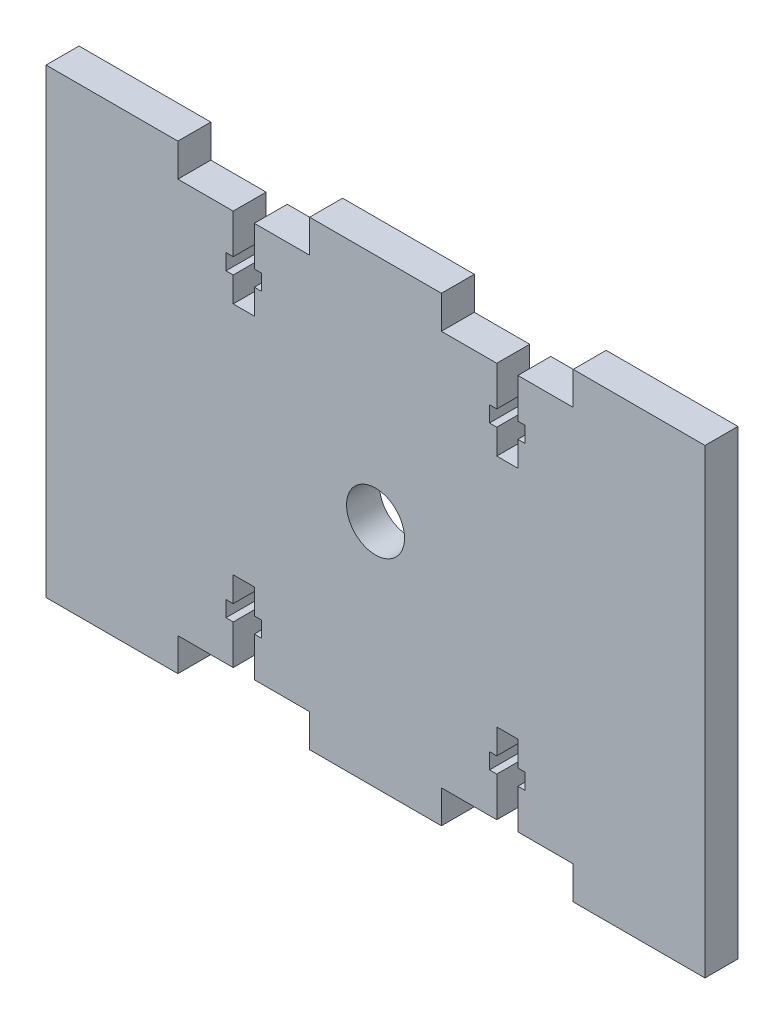
from build123d import *

# Parameters (mm, degrees)
SKETCH2_W           = 127
SKETCH2_H           = 76.2
BOSS_EXTRUDE1_DEPTH = 6.35
SKETCH3_W           = 25.4
SKETCH3_H           = 6.35
BOSS_EXTRUDE2_DEPTH = 6.35
CUT_EXTRUDE1_DEPTH  = 78.771299333
SKETCH5_R           = 5.588
CUT_EXTRUDE2_DEPTH  = 78.771299333


with BuildPart() as part:
    # Sketch2 → Boss-Extrude1 (new body)
    with BuildSketch(Plane.XY):
        Rectangle(SKETCH2_W, SKETCH2_H)
    extrude(amount=BOSS_EXTRUDE1_DEPTH)

    # Sketch3 → Boss-Extrude2 (add)
    with BuildSketch(Plane.XY.offset(6.35)):
        with Locations((0, 41.275)):
            Rectangle(SKETCH3_W, SKETCH3_H)
        with Locations((50.8, 41.275)):
            Rectangle(SKETCH3_W, SKETCH3_H)
        with Locations((50.8, -41.275)):
            Rectangle(SKETCH3_W, SKETCH3_H)
        with Locations((0, -41.275)):
            Rectangle(SKETCH3_W, SKETCH3_H)
        with Locations((-50.8, -41.275)):
            Rectangle(SKETCH3_W, SKETCH3_H)
        with Locations((-50.8, 41.275)):
            Rectangle(SKETCH3_W, SKETCH3_H)
    extrude(amount=-BOSS_EXTRUDE2_DEPTH)

    # Sketch4 → Cut-Extrude1 (cut, through all)
    with BuildSketch(Plane.XY.offset(6.35)):
        Polygon((-27.432, 38.1), (-23.368, 38.1), (-23.368, 30.48), (-21.971, 30.48), (-21.971, 27.432), (-23.368, 27.432), (-23.368, 22.606), (-27.432, 22.606), (-27.432, 27.432), (-28.829, 27.432), (-28.829, 30.48), (-27.432, 30.48), align=None)
        Polygon((27.432, 38.1), (23.368, 38.1), (23.368, 30.48), (21.971, 30.48), (21.971, 27.432), (23.368, 27.432), (23.368, 22.606), (27.432, 22.606), (27.432, 27.432), (28.829, 27.432), (28.829, 30.48), (27.432, 30.48), align=None)
        Polygon((27.432, -38.1), (23.368, -38.1), (23.368, -30.48), (21.971, -30.48), (21.971, -27.432), (23.368, -27.432), (23.368, -22.606), (27.432, -22.606), (27.432, -27.432), (28.829, -27.432), (28.829, -30.48), (27.432, -30.48), align=None)
        Polygon((-27.432, -38.1), (-23.368, -38.1), (-23.368, -30.48), (-21.971, -30.48), (-21.971, -27.432), (-23.368, -27.432), (-23.368, -22.606), (-27.432, -22.606), (-27.432, -27.432), (-28.829, -27.432), (-28.829, -30.48), (-27.432, -30.48), align=None)
    extrude(amount=-CUT_EXTRUDE1_DEPTH, mode=Mode.SUBTRACT)

    # Sketch5 → Cut-Extrude2 (cut, through all)
    with BuildSketch(Plane.XY.offset(6.35)):
        Circle(SKETCH5_R)
    extrude(amount=-CUT_EXTRUDE2_DEPTH, mode=Mode.SUBTRACT)


solid = part.part
